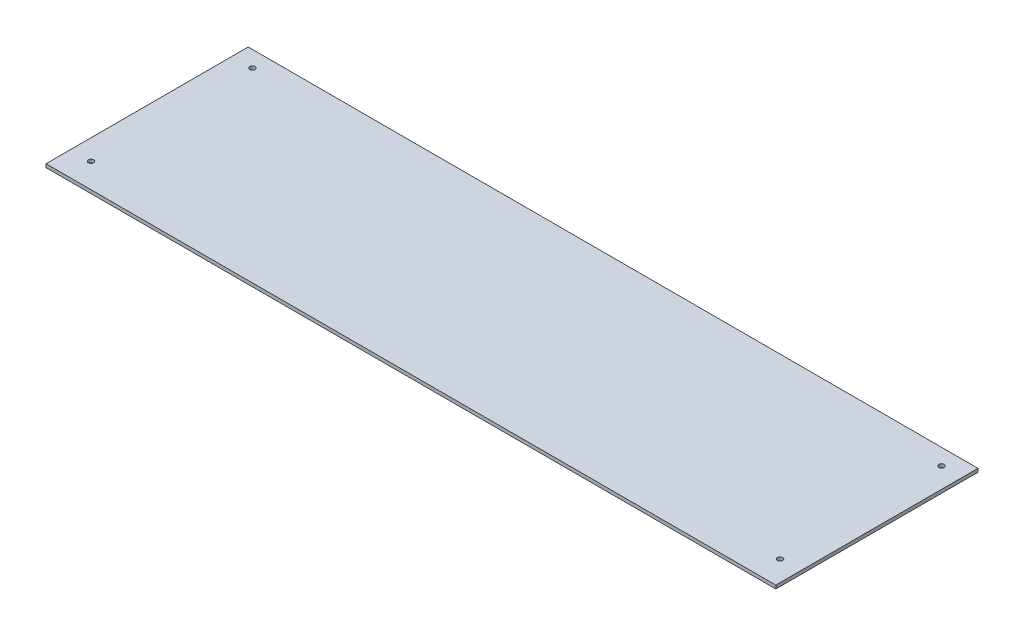
from build123d import *

# Parameters (mm, degrees)
CROQUIS1_W              = 430.5
CROQUIS1_H              = 120
CROQUIS1_R              = 1.55
SALIENTE_EXTRUIR1_DEPTH = 2
CROQUIS2_W              = 430.5
CROQUIS2_H              = 120
CROQUIS2_W_2            = 429.5
CROQUIS2_H_2            = 119
CORTAR_EXTRUIR1_DEPTH   = 2


with BuildPart() as part:
    # Croquis1 → Saliente-Extruir1 (new body)
    with BuildSketch(Plane(origin=(0, 0, 0), x_dir=(1, 0, 0), z_dir=(0, 1, 0))):
        with Locations((215.25, 60)):
            Rectangle(CROQUIS1_W, CROQUIS1_H)
        with Locations(Location((12.5, 15, 0), (0, 0, 270))):
            Circle(CROQUIS1_R, mode=Mode.SUBTRACT)
        with Locations(Location((12.5, 110, 0), (0, 0, 270))):
            Circle(CROQUIS1_R, mode=Mode.SUBTRACT)
        with Locations(Location((418, 15, 0), (0, 0, 90))):
            Circle(CROQUIS1_R, mode=Mode.SUBTRACT)
        with Locations(Location((418, 110, 0), (0, 0, 90))):
            Circle(CROQUIS1_R, mode=Mode.SUBTRACT)
    extrude(amount=SALIENTE_EXTRUIR1_DEPTH)

    # Croquis2 → Cortar-Extruir1 (cut)
    with BuildSketch(Plane.XZ):
        with Locations((215.25, -60)):
            Rectangle(CROQUIS2_W, CROQUIS2_H)
        with Locations((215.25, -60)):
            Rectangle(CROQUIS2_W_2, CROQUIS2_H_2, mode=Mode.SUBTRACT)
    extrude(amount=-CORTAR_EXTRUIR1_DEPTH, mode=Mode.SUBTRACT)


solid = part.part
